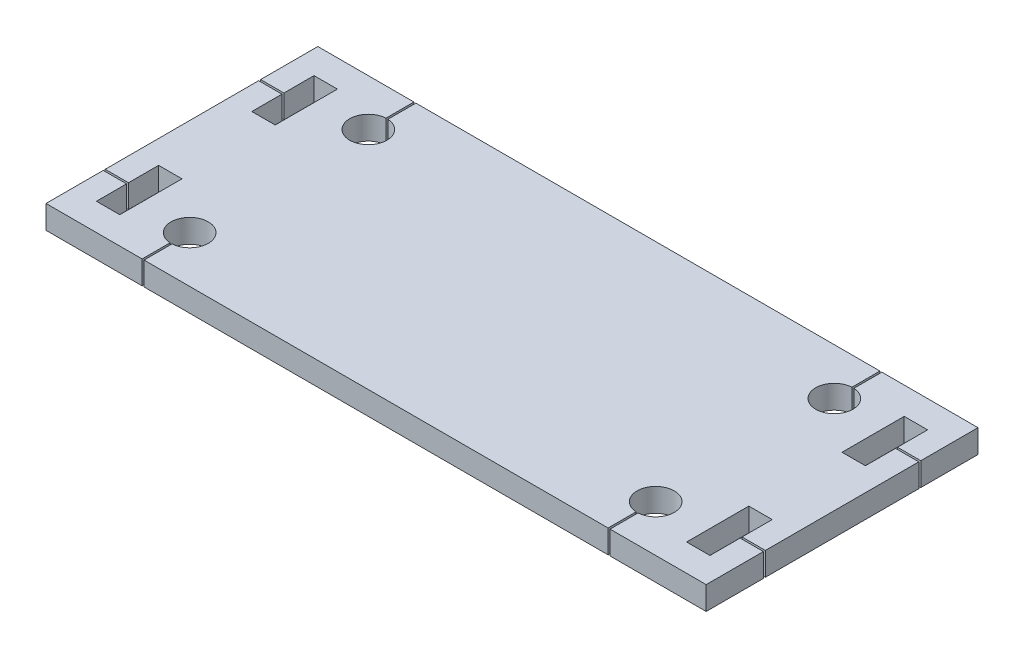
from build123d import *

# Parameters (mm, degrees)
ESBO_O2_W                = 85
ESBO_O2_H                = 35
RESSALTO_EXTRUS_O2_DEPTH = 3
FURO_COM_FOLGA_DE_M41_D  = 4.8
ESBO_O10_W               = 3.01
ESBO_O10_H               = 8.01
CORTE_EXTRUS_O2_DEPTH    = 10
ESBO_O11_W               = 3
ESBO_O11_H               = 0.25
ESBO_O11_W_2             = 0.25
ESBO_O11_H_2             = 3.603257419
CORTE_EXTRUS_O3_DEPTH    = 47.059743812


with BuildPart() as part:
    # Esboço2 → Ressalto-extrusão2 (new body)
    with BuildSketch(Plane(origin=(0, 0, 0), x_dir=(1, 0, 0), z_dir=(0, 1, 0))):
        Rectangle(ESBO_O2_W, ESBO_O2_H)
    extrude(amount=RESSALTO_EXTRUS_O2_DEPTH)

    # Furo com folga de M41 (through all)
    with Locations(Plane(origin=(0, 0, 0), x_dir=(-1, 0, 0), z_dir=(0, -1, 0))):
        with Locations((30, -11.5), (30, 11.5), (-30, 11.5), (-30, -11.5)):
            Hole(FURO_COM_FOLGA_DE_M41_D / 2)

    # Esboço10 → Corte-extrusão2 (cut)
    with BuildSketch(Plane(origin=(0, 3, 0), x_dir=(1, 0, 0), z_dir=(0, 1, 0))):
        with Locations((-37.995, 10.005)):
            Rectangle(ESBO_O10_W, ESBO_O10_H)
        with Locations((-37.995, -10.005)):
            Rectangle(ESBO_O10_W, ESBO_O10_H)
        with Locations((37.995, -10.005)):
            Rectangle(ESBO_O10_W, ESBO_O10_H)
        with Locations((37.995, 10.005)):
            Rectangle(ESBO_O10_W, ESBO_O10_H)
    extrude(amount=-CORTE_EXTRUS_O2_DEPTH, mode=Mode.SUBTRACT)

    # Esboço11 → Corte-extrusão3 (cut, through all)
    with BuildSketch(Plane(origin=(0, 3, 0), x_dir=(1, 0, 0), z_dir=(0, 1, 0))):
        with Locations((-41, 10.005)):
            Rectangle(ESBO_O11_W, ESBO_O11_H)
        with Locations((-30, 15.698371291)):
            Rectangle(ESBO_O11_W_2, ESBO_O11_H_2)
        with Locations((-30, -15.698371291)):
            Rectangle(ESBO_O11_W_2, ESBO_O11_H_2)
        with Locations((-41, -10.005)):
            Rectangle(ESBO_O11_W, ESBO_O11_H)
        with Locations((41, -10.005)):
            Rectangle(ESBO_O11_W, ESBO_O11_H)
        with Locations((30, -15.698371291)):
            Rectangle(ESBO_O11_W_2, ESBO_O11_H_2)
        with Locations((30, 15.698371291)):
            Rectangle(ESBO_O11_W_2, ESBO_O11_H_2)
        with Locations((41, 10.005)):
            Rectangle(ESBO_O11_W, ESBO_O11_H)
    extrude(amount=-CORTE_EXTRUS_O3_DEPTH, mode=Mode.SUBTRACT)


solid = part.part
